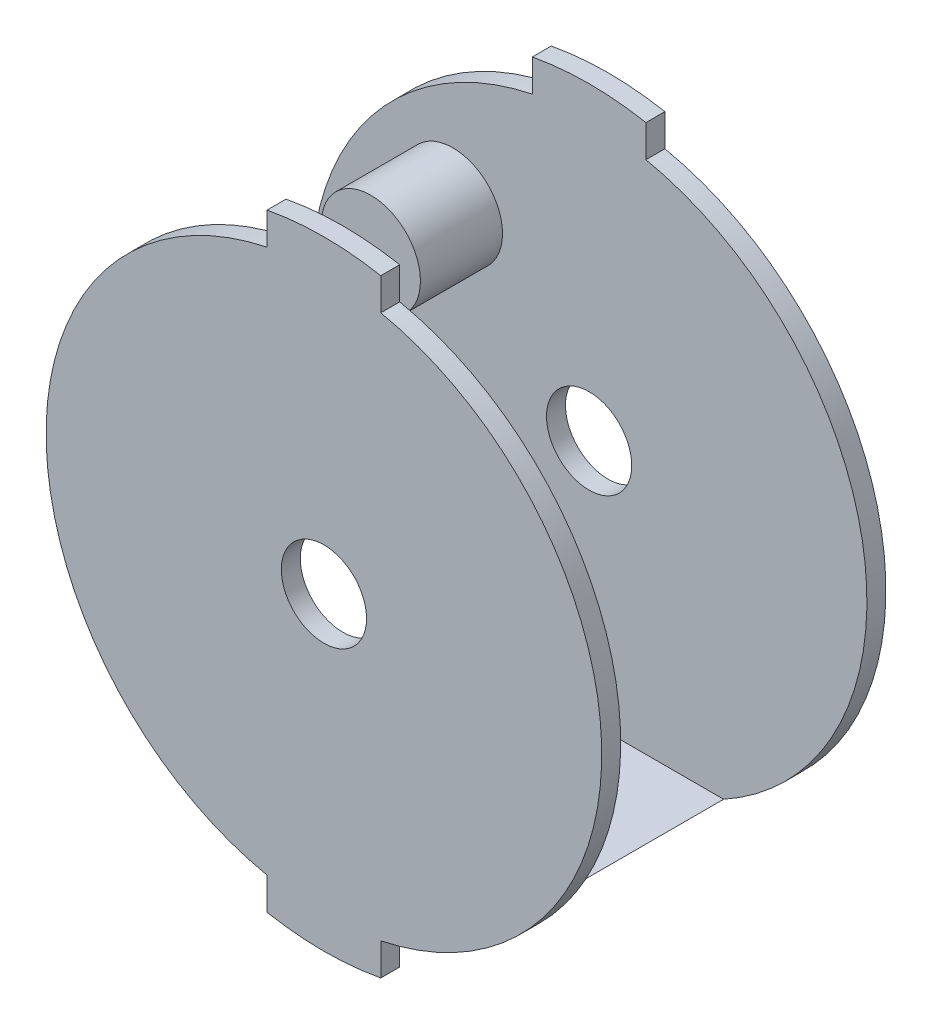
from build123d import *

# Parameters (mm, degrees)
SKETCH1_R               = 1.7145
BOSS_EXTRUDE1_DEPTH     = 11.43
SKETCH2_W               = 9.906
SKETCH2_H               = 2.54
CUT_EXTRUDE1_DEPTH      = 21.259585188
CUT_EXTRUDE1_DEPTH_BACK = 21.259585188
SKETCH4_W               = 9.906
SKETCH4_H               = 20.955
SKETCH4_H_2             = 0.635
SKETCH3_R               = 1.9939
BOSS_EXTRUDE2_DEPTH     = 4.064


with BuildPart() as part:
    # Sketch1 → Boss-Extrude1 (new body)
    with BuildSketch(Plane.XY):
        with BuildLine():
            Line((-2.286, 12.234260092), (-2.286, 10.939706577))
            ThreePointArc((-2.286, 10.939706577), (-11.176, 0), (-2.286, -10.939706577))
            Line((-2.286, -10.939706577), (-2.286, -12.234260092))
            ThreePointArc((-2.286, -12.234260092), (0, -12.446), (2.286, -12.234260092))
            Line((2.286, -12.234260092), (2.286, -10.939706577))
            ThreePointArc((2.286, -10.939706577), (11.176, 0), (2.286, 10.939706577))
            Line((2.286, 10.939706577), (2.286, 12.234260092))
            ThreePointArc((2.286, 12.234260092), (0, 12.446), (-2.286, 12.234260092))
        make_face()
        Circle(SKETCH1_R, mode=Mode.SUBTRACT)
    extrude(amount=BOSS_EXTRUDE1_DEPTH)

    # Sketch2 → Cut-Revolve1 (revolve, cut)
    with BuildSketch(Plane(origin=(0, 0, 0), x_dir=(0, 0, -1), z_dir=(1, 0, 0)), mode=Mode.PRIVATE) as cut_revolve1_sk:
        with Locations((-5.715, 12.446)):
            Rectangle(SKETCH2_W, SKETCH2_H)
    revolve(cut_revolve1_sk.sketch.rotate(Axis((0, 0, 11.43), (0, 0, -1)), 348.19710831), axis=Axis((0, 0, 11.43), (0, 0, -1)), mode=Mode.SUBTRACT)

    # Sketch4 → Cut-Extrude1 (cut, two sides: drawn at the far end of the back side and taken through both)
    with BuildSketch(Plane(origin=(0, 0, 0), x_dir=(0, 0, -1), z_dir=(1, 0, 0)).offset(-CUT_EXTRUDE1_DEPTH_BACK)):
        with Locations((-5.715, 0.6985)):
            Rectangle(SKETCH4_W, SKETCH4_H)
        with Locations((-5.715, -10.8585)):
            Rectangle(SKETCH4_W, SKETCH4_H_2)
    extrude(amount=CUT_EXTRUDE1_DEPTH + CUT_EXTRUDE1_DEPTH_BACK, mode=Mode.SUBTRACT)

    # Sketch3 → Boss-Extrude2 (add)
    with BuildSketch(Plane.XY):
        with Locations((-5.477956234, 5.477956234)):
            Circle(SKETCH3_R)
    extrude(amount=BOSS_EXTRUDE2_DEPTH)


solid = part.part
